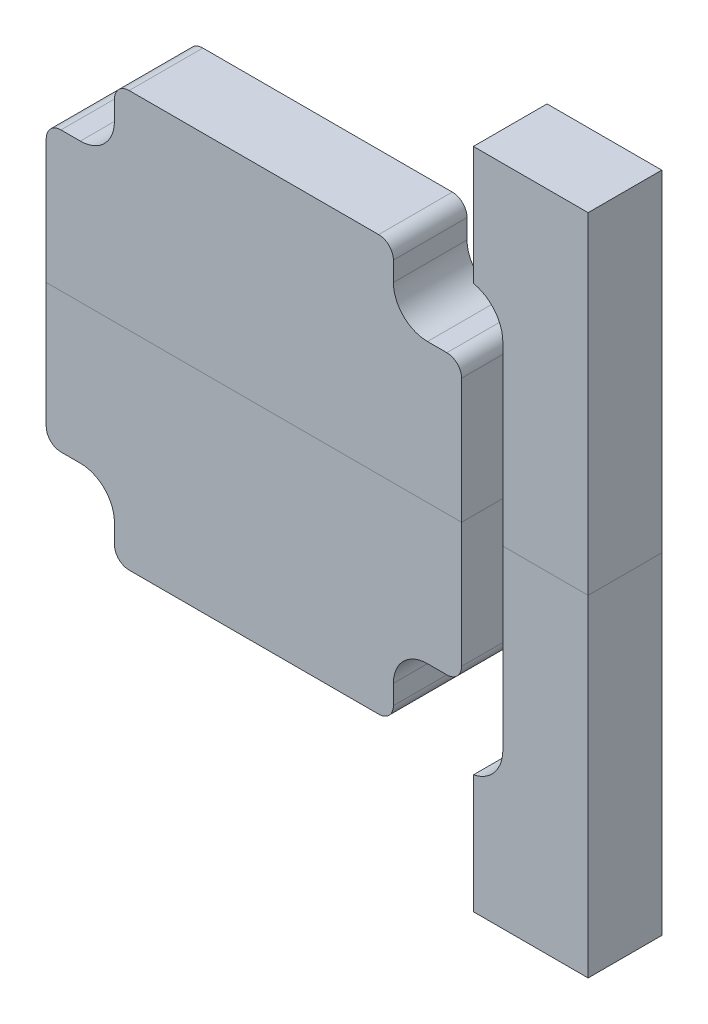
from build123d import *

# Parameters (mm, degrees)
BOSS_EXTRUDE1_DEPTH   = 10
BOSS_EXTRUDE1_2_DEPTH = 10


with BuildPart() as part:
    # Sketch1 → Boss-Extrude1 (new body)
    with BuildSketch(Plane.XY):
        with BuildLine():
            Line((-162.76, 0), (-162.76, 16.94))
            ThreePointArc((-162.76, 16.94), (-163.345786438, 18.354213562), (-164.76, 18.94))
            Line((-164.76, 18.94), (-167.39, 18.94))
            ThreePointArc((-167.39, 18.94), (-170.663904397, 20.296095603), (-172.02, 23.57))
            Line((-172.02, 23.57), (-172.02, 26.2))
            ThreePointArc((-172.02, 26.2), (-172.605786438, 27.614213562), (-174.02, 28.2))
            Line((-174.02, 28.2), (-207.9, 28.2))
            ThreePointArc((-207.9, 28.2), (-209.314213562, 27.614213562), (-209.9, 26.2))
            Line((-209.9, 26.2), (-209.9, 23.57))
            ThreePointArc((-209.9, 23.57), (-211.256095603, 20.296095603), (-214.53, 18.94))
            Line((-214.53, 18.94), (-217.16, 18.94))
            ThreePointArc((-217.16, 18.94), (-218.574213562, 18.354213562), (-219.16, 16.94))
            Line((-219.16, 16.94), (-219.16, 0))
            Line((-219.16, 0), (-162.76, 0))
        make_face()
    extrude(amount=BOSS_EXTRUDE1_DEPTH)


with BuildPart() as body_2:
    # Sketch1 → Boss-Extrude1 2 (new body)
    with BuildSketch(Plane.XY):
        with BuildLine():
            Line((-145.58, 45), (-145.58, 0))
            Line((-145.58, 0), (-157.16, 0))
            Line((-157.16, 0), (-157.16, 24))
            ThreePointArc((-157.16, 24), (-158.287016654, 27.16227766), (-161.16, 28.898979486))
            Line((-161.16, 28.898979486), (-161.16, 45))
            Line((-161.16, 45), (-151.16, 45))
            Line((-151.16, 45), (-145.58, 45))
        make_face()
    extrude(amount=BOSS_EXTRUDE1_2_DEPTH)


with BuildPart() as body_3:
    # Mirror1: mirrored copy
    add(part.part.mirror(Plane(origin=(-219.16, 0, 10), x_dir=(0, 0, 1), z_dir=(0, 1, 0))))


with BuildPart() as body_4:
    # Mirror1 2: mirrored copy
    add(body_2.part.mirror(Plane(origin=(-219.16, 0, 10), x_dir=(0, 0, 1), z_dir=(0, 1, 0))))


solid = Compound([part.part, body_2.part, body_3.part, body_4.part])
